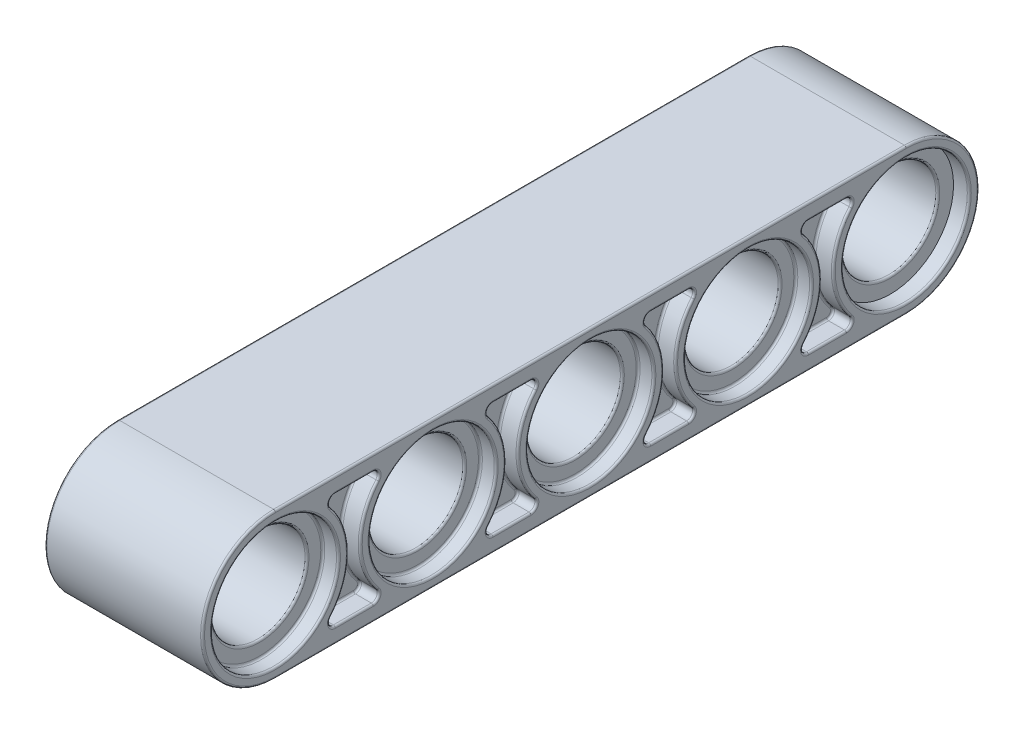
from build123d import *

# Parameters (mm, degrees)
SKETCH1_R           = 2.4
BOSS_EXTRUDE1_DEPTH = 8
SKETCH2_R           = 3.2
CUT_EXTRUDE1_DEPTH  = 0.8
CUT_EXTRUDE2_START  = -1
CUT_EXTRUDE2_DEPTH  = 1
FILLET1_R           = 0.1
FILLET2_R           = 0.1


with BuildPart() as part:
    # Sketch1 → Boss-Extrude1 (new body)
    with BuildSketch(Plane(origin=(0, 0, 0), x_dir=(0, 0, -1), z_dir=(1, 0, 0))):
        with BuildLine():
            Line((-15.56462585, 3.7), (16.43537415, 3.7))
            ThreePointArc((16.43537415, 3.7), (20.13537415, 0), (16.43537415, -3.7))
            Line((16.43537415, -3.7), (-15.56462585, -3.7))
            ThreePointArc((-15.56462585, -3.7), (-19.26462585, 0), (-15.56462585, 3.7))
        make_face()
        with Locations((-15.56462585, 0)):
            Circle(SKETCH1_R, mode=Mode.SUBTRACT)
        with Locations((-7.56462585, 0)):
            Circle(SKETCH1_R, mode=Mode.SUBTRACT)
        with Locations((0.43537415, 0)):
            Circle(SKETCH1_R, mode=Mode.SUBTRACT)
        with Locations((8.43537415, 0)):
            Circle(SKETCH1_R, mode=Mode.SUBTRACT)
        with Locations((16.43537415, 0)):
            Circle(SKETCH1_R, mode=Mode.SUBTRACT)
    extrude(amount=BOSS_EXTRUDE1_DEPTH)

    # Sketch2 → Cut-Extrude1 (cut)
    with BuildSketch(Plane(origin=(8, 0, 0), x_dir=(0, 0, -1), z_dir=(1, 0, 0))):
        with Locations((-15.56462585, 0)):
            Circle(SKETCH2_R)
        with Locations((-7.56462585, 0)):
            Circle(SKETCH2_R)
        with Locations((0.43537415, 0)):
            Circle(SKETCH2_R)
        with Locations((8.43537415, 0)):
            Circle(SKETCH2_R)
        with Locations((16.43537415, 0)):
            Circle(SKETCH2_R)
    cut_extrude1 = extrude(amount=-CUT_EXTRUDE1_DEPTH, mode=Mode.SUBTRACT)

    # Sketch4 → Cut-Extrude2 (cut)
    with BuildSketch(Plane(origin=(8, 0, 0), x_dir=(0, 0, -1), z_dir=(1, 0, 0)).offset(CUT_EXTRUDE2_START)):
        with BuildLine():
            Line((-12.52488902, 2.9), (-10.604362681, 2.9))
            ThreePointArc((-10.604362681, 2.9), (-10.331874149, 2.725499004), (-10.376382419, 2.405))
            ThreePointArc((-10.376382419, 2.405), (-11.26462585, 0), (-10.376382419, -2.405))
            ThreePointArc((-10.376382419, -2.405), (-10.331874149, -2.725499004), (-10.604362681, -2.9))
            Line((-10.604362681, -2.9), (-12.52488902, -2.9))
            ThreePointArc((-12.52488902, -2.9), (-12.797377551, -2.725499004), (-12.752869282, -2.405))
            ThreePointArc((-12.752869282, -2.405), (-11.86462585, 0), (-12.752869282, 2.405))
            ThreePointArc((-12.752869282, 2.405), (-12.797377551, 2.725499004), (-12.52488902, 2.9))
        make_face()
        with BuildLine():
            Line((-4.52488902, 2.9), (-2.604362681, 2.9))
            ThreePointArc((-2.604362681, 2.9), (-2.331874149, 2.725499004), (-2.376382419, 2.405))
            ThreePointArc((-2.376382419, 2.405), (-3.26462585, 0), (-2.376382419, -2.405))
            ThreePointArc((-2.376382419, -2.405), (-2.331874149, -2.725499004), (-2.604362681, -2.9))
            Line((-2.604362681, -2.9), (-4.52488902, -2.9))
            ThreePointArc((-4.52488902, -2.9), (-4.797377551, -2.725499004), (-4.752869282, -2.405))
            ThreePointArc((-4.752869282, -2.405), (-3.86462585, 0), (-4.752869282, 2.405))
            ThreePointArc((-4.752869282, 2.405), (-4.797377551, 2.725499004), (-4.52488902, 2.9))
        make_face()
        with BuildLine():
            Line((3.47511098, 2.9), (5.395637319, 2.9))
            ThreePointArc((5.395637319, 2.9), (5.668125851, 2.725499004), (5.623617581, 2.405))
            ThreePointArc((5.623617581, 2.405), (4.73537415, 0), (5.623617581, -2.405))
            ThreePointArc((5.623617581, -2.405), (5.668125851, -2.725499004), (5.395637319, -2.9))
            Line((5.395637319, -2.9), (3.47511098, -2.9))
            ThreePointArc((3.47511098, -2.9), (3.202622449, -2.725499004), (3.247130718, -2.405))
            ThreePointArc((3.247130718, -2.405), (4.13537415, 0), (3.247130718, 2.405))
            ThreePointArc((3.247130718, 2.405), (3.202622449, 2.725499004), (3.47511098, 2.9))
        make_face()
        with BuildLine():
            Line((11.47511098, 2.9), (13.395637319, 2.9))
            ThreePointArc((13.395637319, 2.9), (13.668125851, 2.725499004), (13.623617581, 2.405))
            ThreePointArc((13.623617581, 2.405), (12.73537415, 0), (13.623617581, -2.405))
            ThreePointArc((13.623617581, -2.405), (13.668125851, -2.725499004), (13.395637319, -2.9))
            Line((13.395637319, -2.9), (11.47511098, -2.9))
            ThreePointArc((11.47511098, -2.9), (11.202622449, -2.725499004), (11.247130718, -2.405))
            ThreePointArc((11.247130718, -2.405), (12.13537415, 0), (11.247130718, 2.405))
            ThreePointArc((11.247130718, 2.405), (11.202622449, 2.725499004), (11.47511098, 2.9))
        make_face()
    cut_extrude2 = extrude(amount=CUT_EXTRUDE2_DEPTH, mode=Mode.SUBTRACT)

    # Mirror1: Cut-Extrude1, Cut-Extrude2 across plane
    add(cut_extrude1.mirror(Plane(origin=(4, 0, 0), x_dir=(0, 0, 1), z_dir=(1, 0, 0))), mode=Mode.SUBTRACT)
    add(cut_extrude2.mirror(Plane(origin=(4, 0, 0), x_dir=(0, 0, 1), z_dir=(1, 0, 0))), mode=Mode.SUBTRACT)

    # Fillet1
    fillet1_edges = [part.edges().sort_by_distance(p)[0] for p in [
        (0, -3.7, -0.43537415),
        (0, 0, -20.13537415),
        (1, -2.9, -12.43537415),
        (1, -2.725499004, -13.668125851),
        (1, 0, -12.73537415),
        (1, 2.725499004, -13.668125851),
        (1, 2.9, -12.43537415),
        (1, 2.725499004, -11.202622449),
        (1, 0, -12.13537415),
        (1, -2.725499004, -11.202622449),
        (0, 0, 19.26462585),
        (0.8, 0, -13.23537415),
        (0.8, 0, -5.23537415),
        (1, -2.9, -4.43537415),
        (1, -2.725499004, -5.668125851),
        (1, 0, -4.73537415),
        (1, 2.725499004, -5.668125851),
        (1, 2.9, -4.43537415),
        (1, 2.725499004, -3.202622449),
        (1, 0, -4.13537415),
        (1, -2.725499004, -3.202622449),
        (0.8, 0, 2.76462585),
        (1, -2.9, 3.56462585),
        (1, -2.725499004, 2.331874149),
        (1, 0, 3.26462585),
        (1, 2.725499004, 2.331874149),
        (1, 2.9, 3.56462585),
        (1, 2.725499004, 4.797377551),
        (0.8, 0, 10.76462585),
        (1, -2.9, 11.56462585),
        (1, -2.725499004, 10.331874149),
        (1, 0, 11.26462585),
        (1, 2.725499004, 10.331874149),
        (1, 2.725499004, 12.797377551),
        (1, 0, 11.86462585),
        (1, -2.725499004, 12.797377551),
        (0.8, 0, 18.76462585),
        (0, 3.7, -0.43537415),
        (0.8, 0, -14.03537415),
        (7.2, 0, -14.03537415),
        (7, 0, -12.13537415),
        (7, 2.725499004, -11.202622449),
        (7, 2.9, -12.43537415),
        (7, 0, -12.73537415),
        (7, -2.725499004, -13.668125851),
        (7, -2.9, -12.43537415),
        (7, -2.725499004, -11.202622449),
        (0.8, 0, -6.03537415),
        (7.2, 0, -5.23537415),
        (7.2, 0, -6.03537415),
        (7, 0, -4.13537415),
        (7, 2.725499004, -3.202622449),
        (7, 2.9, -4.43537415),
        (7, 2.725499004, -5.668125851),
        (7, 0, -4.73537415),
        (7, -2.725499004, -5.668125851),
        (7, -2.9, -4.43537415),
        (7, -2.725499004, -3.202622449),
        (0.8, 0, 1.96462585),
        (7.2, 0, 2.76462585),
        (7.2, 0, 1.96462585),
        (7, 0, 3.86462585),
        (7, 2.725499004, 4.797377551),
        (7, 2.9, 3.56462585),
        (7, 2.725499004, 2.331874149),
        (7, 0, 3.26462585),
        (7, -2.725499004, 2.331874149),
        (7, -2.9, 3.56462585),
        (7, -2.725499004, 4.797377551),
        (0.8, 0, 9.96462585),
        (7.2, 0, 10.76462585),
        (7.2, 0, 9.96462585),
        (7, 0, 11.86462585),
        (7, 2.725499004, 12.797377551),
        (7, 2.725499004, 10.331874149),
        (7, 0, 11.26462585),
        (7, -2.725499004, 10.331874149),
        (7, -2.9, 11.56462585),
        (7, -2.725499004, 12.797377551),
        (7.2, 0, 18.76462585),
        (0.8, 0, 17.96462585),
        (7.2, 0, 17.96462585),
        (8, 3.7, -0.43537415),
        (8, 0, -20.13537415),
        (8, -3.7, -0.43537415),
        (8, 0, 19.26462585),
        (8, 0, 18.76462585),
        (8, 0, 10.76462585),
        (8, 0, 2.76462585),
        (8, 0, -5.23537415),
        (8, 0, -13.23537415),
        (8, -2.9, 11.56462585),
        (8, -2.725499004, 10.331874149),
        (8, 0, 11.26462585),
        (8, 2.725499004, 10.331874149),
        (8, 2.9, 11.56462585),
        (8, 2.725499004, 12.797377551),
        (8, 0, 11.86462585),
        (8, -2.725499004, 12.797377551),
        (8, -2.9, 3.56462585),
        (8, -2.725499004, 2.331874149),
        (8, 0, 3.26462585),
        (8, 2.725499004, 2.331874149),
        (8, 2.9, 3.56462585),
        (8, 2.725499004, 4.797377551),
        (8, 0, 3.86462585),
        (8, -2.725499004, 4.797377551),
        (8, -2.9, -4.43537415),
        (8, -2.725499004, -5.668125851),
        (8, 0, -4.73537415),
        (8, 2.725499004, -5.668125851),
        (8, 2.9, -4.43537415),
        (8, 2.725499004, -3.202622449),
        (8, 0, -4.13537415),
        (8, -2.725499004, -3.202622449),
        (8, -2.9, -12.43537415),
        (8, -2.725499004, -13.668125851),
        (8, 0, -12.73537415),
        (8, 2.725499004, -13.668125851),
        (8, 2.9, -12.43537415),
        (8, 2.725499004, -11.202622449),
        (8, 0, -12.13537415),
        (8, -2.725499004, -11.202622449),
    ]]
    fillet(fillet1_edges, radius=FILLET1_R)

    # Fillet2
    fillet2_edges = [part.edges().sort_by_distance(p)[0] for p in [
        (0, 0, 18.76462585),
        (0, 0, 10.76462585),
        (0, 0, 2.76462585),
        (0, 0, -5.23537415),
        (0, 0, -13.23537415),
        (0, -2.725499004, 12.797377551),
        (0, -2.9, 11.56462585),
        (0, -2.725499004, 10.331874149),
        (0, 0, 11.26462585),
        (0, 2.725499004, 10.331874149),
        (0, 2.9, 11.56462585),
        (0, 2.725499004, 12.797377551),
        (0, 0, 11.86462585),
        (0, -2.725499004, 4.797377551),
        (0, -2.9, 3.56462585),
        (0, -2.725499004, 2.331874149),
        (0, 0, 3.26462585),
        (0, 2.725499004, 2.331874149),
        (0, 2.9, 3.56462585),
        (0, 2.725499004, 4.797377551),
        (0, 0, 3.86462585),
        (0, -2.725499004, -3.202622449),
        (0, -2.9, -4.43537415),
        (0, -2.725499004, -5.668125851),
        (0, 0, -4.73537415),
        (0, 2.725499004, -5.668125851),
        (0, 2.9, -4.43537415),
        (0, 2.725499004, -3.202622449),
        (0, 0, -4.13537415),
        (0, -2.725499004, -11.202622449),
        (0, -2.9, -12.43537415),
        (0, -2.725499004, -13.668125851),
        (0, 0, -12.73537415),
        (0, 2.725499004, -13.668125851),
        (0, 2.9, -12.43537415),
        (0, 2.725499004, -11.202622449),
        (0, 0, -12.13537415),
    ]]
    fillet(fillet2_edges, radius=FILLET2_R)


solid = part.part
